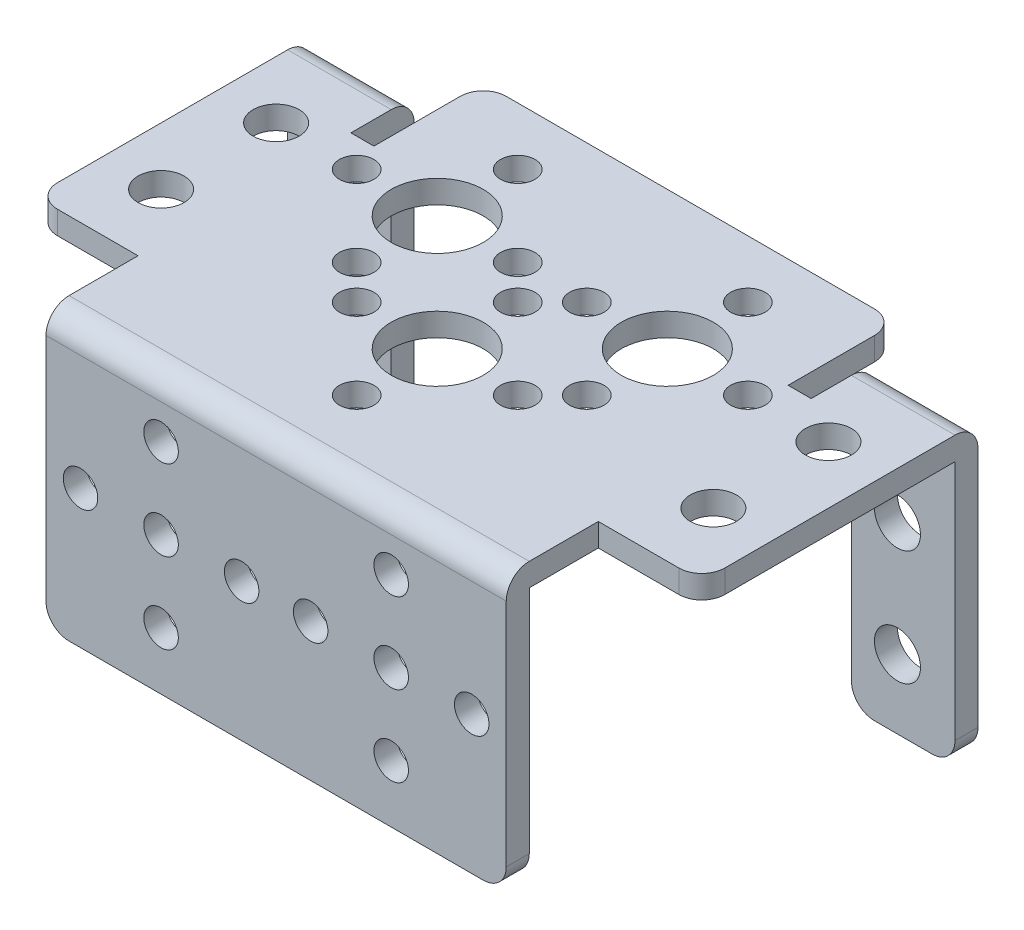
from build123d import *

# Parameters (mm, degrees)
SKETCH_208_R           = 4
SKETCH_208_R_2         = 1.5
SKETCH_208_R_3         = 2
EXTRUDE_1_DEPTH        = 2
SKETCH_3_R             = 2
EXTRUDE_2_DEPTH        = 2
SKETCH_4_W             = 20
SKETCH_4_H             = 22
SKETCH_4_R             = 1.5
EXTRUDE_3_DEPTH        = 2
FILLET_1_R             = 2
FILLET_1_OF_MIRROR_1_R = 2


with BuildPart() as part:
    # Sketch 208 → 凸台-拉伸1 (new body)
    with BuildSketch(Plane(origin=(0, 0, 0), x_dir=(1, 0, 0), z_dir=(0, 1, 0))):
        with BuildLine():
            Line((0, 36), (18, 36))
            Line((18, 36), (18, 26.5))
            Line((18, 26.5), (20, 26.5))
            Line((20, 26.5), (20, 32))
            Line((20, 32), (29, 32))
            Line((29, 32), (29, 8))
            Line((29, 8), (20, 8))
            Line((20, 8), (20, 0))
            Line((20, 0), (0, 0))
            Line((0, 0), (0, 5.5))
            ThreePointArc((0, 5.5), (1.5, 7), (0, 8.5))
            Line((0, 8.5), (0, 10))
            ThreePointArc((0, 10), (4, 14), (0, 18))
            Line((0, 18), (0, 19.5))
            ThreePointArc((0, 19.5), (1.5, 21), (0, 22.5))
            Line((0, 22.5), (0, 36))
        make_face()
        with Locations(Location((10, 24, 0), (0, 0, 270))):
            Circle(SKETCH_208_R, mode=Mode.SUBTRACT)
        with Locations(Location((10, 31, 0), (0, 0, 270))):
            Circle(SKETCH_208_R_2, mode=Mode.SUBTRACT)
        with Locations(Location((17, 24, 0), (0, 0, 270))):
            Circle(SKETCH_208_R_2, mode=Mode.SUBTRACT)
        with Locations(Location((10, 17, 0), (0, 0, 270))):
            Circle(SKETCH_208_R_2, mode=Mode.SUBTRACT)
        with Locations(Location((3, 24, 0), (0, 0, 270))):
            Circle(SKETCH_208_R_2, mode=Mode.SUBTRACT)
        with Locations(Location((7, 14, 0), (0, 0, 270))):
            Circle(SKETCH_208_R_2, mode=Mode.SUBTRACT)
        with Locations(Location((24, 24, 0), (0, 0, 270))):
            Circle(SKETCH_208_R_3, mode=Mode.SUBTRACT)
        with Locations(Location((24, 14, 0), (0, 0, 270))):
            Circle(SKETCH_208_R_3, mode=Mode.SUBTRACT)
    extrude_1 = extrude(amount=EXTRUDE_1_DEPTH)

    # 草图3 → 凸台-拉伸2 (add)
    with BuildSketch(Plane(origin=(0, 0, -32), x_dir=(-1, 0, 0), z_dir=(0, 0, -1))):
        Polygon((-20, 0), (-20, -23), (-29, -23), (-29, 0), (-29, 2), (-20, 2), align=None)
        with Locations((-24, -17)):
            Circle(SKETCH_3_R, mode=Mode.SUBTRACT)
        with Locations((-24, -7)):
            Circle(SKETCH_3_R, mode=Mode.SUBTRACT)
    extrude_2 = extrude(amount=-EXTRUDE_2_DEPTH)

    # 草图4 → 凸台-拉伸3 (add)
    with BuildSketch(Plane.XY):
        with Locations((10, -11)):
            Rectangle(SKETCH_4_W, SKETCH_4_H)
        with Locations((10, -10)):
            Circle(SKETCH_4_R, mode=Mode.SUBTRACT)
        with Locations((17, -10)):
            Circle(SKETCH_4_R, mode=Mode.SUBTRACT)
        with Locations((10, -17)):
            Circle(SKETCH_4_R, mode=Mode.SUBTRACT)
        with Locations((3, -10)):
            Circle(SKETCH_4_R, mode=Mode.SUBTRACT)
        with Locations((10, -3)):
            Circle(SKETCH_4_R, mode=Mode.SUBTRACT)
    extrude_3 = extrude(amount=-EXTRUDE_3_DEPTH)

    # 圆角1
    fillet_1_edges = [part.edges().sort_by_distance(p)[0] for p in [
        (20, -22, -1),
        (18, 1, -36),
        (29, 1, -8),
        (10, 2, 0),
        (24.5, 2, -32),
        (29, -23, -31),
        (20, -23, -31),
    ]]
    fillet(fillet_1_edges, radius=FILLET_1_R)

    # 镜向1: 凸台-拉伸1, 凸台-拉伸2, 凸台-拉伸3 across plane
    add(extrude_1.mirror(Plane(origin=(0, 0, 0), x_dir=(0, 0, 1), z_dir=(1, 0, 0))))
    add(extrude_2.mirror(Plane(origin=(0, 0, 0), x_dir=(0, 0, 1), z_dir=(1, 0, 0))))
    add(extrude_3.mirror(Plane(origin=(0, 0, 0), x_dir=(0, 0, 1), z_dir=(1, 0, 0))))

    # 圆角1 of 镜向1
    fillet_1_of_mirror_1_edges = [part.edges().sort_by_distance(p)[0] for p in [
        (-20, -22, -1),
        (-18, 1, -36),
        (-29, 1, -8),
        (-10, 2, 0),
        (-24.5, 2, -32),
        (-29, -23, -31),
        (-20, -23, -31),
    ]]
    fillet(fillet_1_of_mirror_1_edges, radius=FILLET_1_OF_MIRROR_1_R)


solid = part.part
